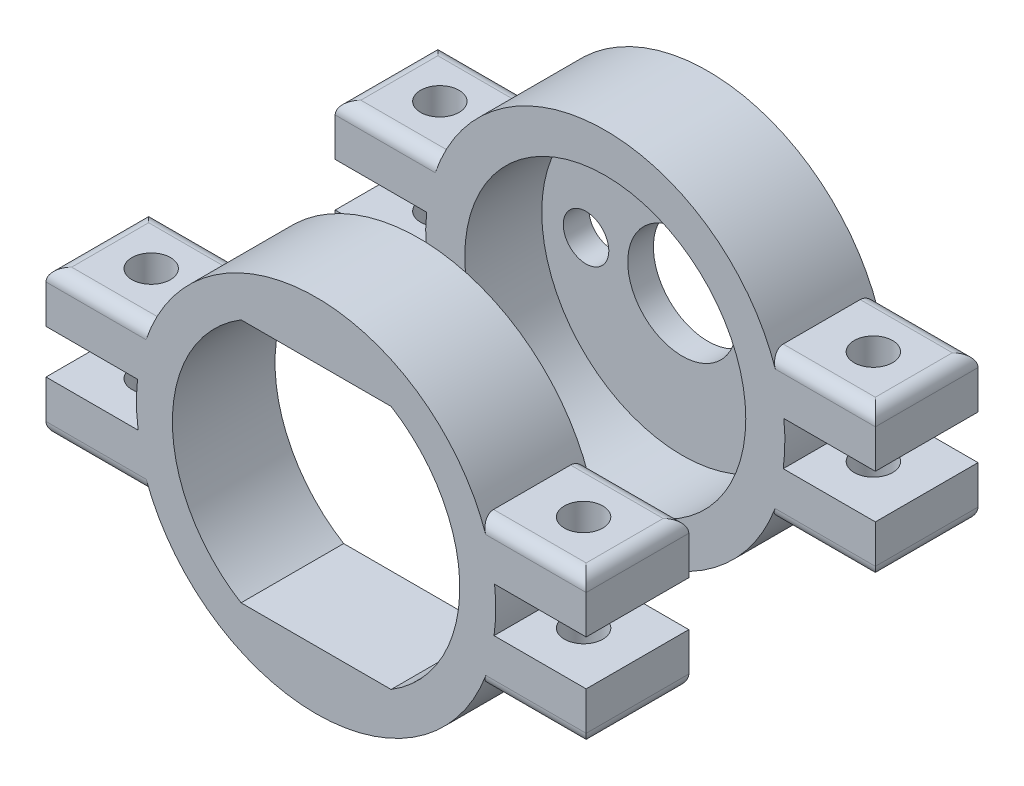
from build123d import *

# Parameters (mm, degrees)
SALIENTE_EXTRUIR1_DEPTH     = 8
CROQUIS2_R                  = 10.95
CORTAR_EXTRUIR1_DEPTH       = 6
CROQUIS3_R                  = 4.25
CROQUIS3_R_2                = 1.775
CORTAR_EXTRUIR2_DEPTH       = 3.5
SALIENTE_EXTRUIR3_DEPTH     = 8
CORTAR_EXTRUIR8_DEPTH       = 10
CORTAR_EXTRUIR9_DEPTH       = 44.54426019
CORTAR_EXTRUIR9_DEPTH_BACK  = 44.54426019
CROQUIS11_W                 = 3
CROQUIS11_H                 = 30.54
CORTAR_EXTRUIR10_DEPTH      = 42.961939121
CORTAR_EXTRUIR10_DEPTH_BACK = 42.961939121
CROQUIS8_R                  = 1.5
REDONDEO1_R                 = 1
REDONDEO2_R                 = 1


with BuildPart() as part:
    # Croquis1 → Saliente-Extruir1 (new body)
    with BuildSketch(Plane.XY):
        with BuildLine():
            Line((-13.918830485, 1.505376344), (-24.049710109, 1.505376344))
            Line((-24.049710109, 1.505376344), (-24.049710109, 5.505376344))
            Line((-24.049710109, 5.505376344), (-12.869714009, 5.505376344))
            ThreePointArc((-12.869714009, 5.505376344), (0, 13.997810806), (12.869714009, 5.505376344))
            Line((12.869714009, 5.505376344), (24.049710109, 5.505376344))
            Line((24.049710109, 5.505376344), (24.014276756, 1.505376344))
            Line((24.014276756, 1.505376344), (13.918830485, 1.505376344))
            ThreePointArc((13.918830485, 1.505376344), (13.998517204, -0.203754945), (13.869120376, -1.909842925))
            Line((13.869120376, -1.909842925), (24, -1.909842925))
            Line((24, -1.909842925), (24, -5.909842925))
            Line((24, -5.909842925), (12.8200039, -5.909842925))
            ThreePointArc((12.8200039, -5.909842925), (0, -14.11661232), (-12.8200039, -5.909842925))
            Line((-12.8200039, -5.909842925), (-24, -5.909842925))
            Line((-24, -5.909842925), (-24, -1.909842925))
            Line((-24, -1.909842925), (-13.869120376, -1.909842925))
            ThreePointArc((-13.869120376, -1.909842925), (-13.998517204, -0.203754945), (-13.918830485, 1.505376344))
        make_face()
    extrude(amount=SALIENTE_EXTRUIR1_DEPTH)

    # Croquis2 → Cortar-Extruir1 (cut)
    with BuildSketch(Plane.XY.offset(8)):
        Circle(CROQUIS2_R)
    extrude(amount=-CORTAR_EXTRUIR1_DEPTH, mode=Mode.SUBTRACT)

    # Croquis3 → Cortar-Extruir2 (cut)
    with BuildSketch(Plane.XY.offset(2)):
        Circle(CROQUIS3_R)
        with Locations((-7.5, 0)):
            Circle(CROQUIS3_R_2)
        with Locations((7.5, 0)):
            Circle(CROQUIS3_R_2)
    extrude(amount=-CORTAR_EXTRUIR2_DEPTH, mode=Mode.SUBTRACT)


with BuildPart() as body_2:
    # Croquis6 → Saliente-Extruir3 (new body)
    with BuildSketch(Plane.XY.offset(22.54)):
        with BuildLine():
            Line((-12.869714009, 5.505376344), (-24, 5.505376344))
            Line((-24, 5.505376344), (-24, 1.505376344))
            Line((-24, 1.505376344), (-13.918830485, 1.505376344))
            ThreePointArc((-13.918830485, 1.505376344), (-13.998517204, -0.203754945), (-13.869120376, -1.909842925))
            Line((-13.869120376, -1.909842925), (-24, -1.909842925))
            Line((-24, -1.909842925), (-24, -5.909842925))
            Line((-24, -5.909842925), (-12.8200039, -5.909842925))
            ThreePointArc((-12.8200039, -5.909842925), (0, -14.11661232), (12.8200039, -5.909842925))
            Line((12.8200039, -5.909842925), (24, -5.909842925))
            Line((24, -5.909842925), (24, -1.909842925))
            Line((24, -1.909842925), (13.869120376, -1.909842925))
            ThreePointArc((13.869120376, -1.909842925), (13.999072992, -0.161106695), (13.909399717, 1.590157075))
            Line((13.909399717, 1.590157075), (24, 1.590157075))
            Line((24, 1.590157075), (24, 5.590157075))
            Line((24, 5.590157075), (12.833115415, 5.590157075))
            ThreePointArc((12.833115415, 5.590157075), (-0.046171499, 13.997734658), (-12.869714009, 5.505376344))
        make_face()
    extrude(amount=SALIENTE_EXTRUIR3_DEPTH)

    # Croquis7 → Cortar-Extruir8 (cut)
    with BuildSketch(Plane.XY.offset(30.54)):
        with BuildLine():
            Line((-5.848709946, 9.551575366), (5.848709946, 9.551575366))
            ThreePointArc((5.848709946, 9.551575366), (11.2, 0), (5.848709946, -9.551575366))
            Line((5.848709946, -9.551575366), (-5.848709946, -9.551575366))
            ThreePointArc((-5.848709946, -9.551575366), (-11.2, 0), (-5.848709946, 9.551575366))
        make_face()
    extrude(amount=-CORTAR_EXTRUIR8_DEPTH, mode=Mode.SUBTRACT)


with BuildPart() as cortar_extruir9_tool:
    # Croquis11 → Cortar-Extruir9 (new, two sides: drawn at the far end of the back side and taken through both)
    with BuildSketch(Plane(origin=(0, 5.505376344, 0), x_dir=(1, 0, 0), z_dir=(0, 1, 0)).offset(-CORTAR_EXTRUIR9_DEPTH_BACK)):
        with Locations((-22.549710109, -15.27)):
            Rectangle(CROQUIS11_W, CROQUIS11_H)
        with Locations((22.549710109, -15.27)):
            Rectangle(CROQUIS11_W, CROQUIS11_H)
    extrude(amount=CORTAR_EXTRUIR9_DEPTH + CORTAR_EXTRUIR9_DEPTH_BACK)


with BuildPart() as part_1:
    add(part.part)

    # Cortar-Extruir9: cut by cortar_extruir9_tool
    add(cortar_extruir9_tool.part, mode=Mode.SUBTRACT)


with BuildPart() as body_2_1:
    add(body_2.part)

    # Cortar-Extruir9: cut by cortar_extruir9_tool
    add(cortar_extruir9_tool.part, mode=Mode.SUBTRACT)


with BuildPart() as cortar_extruir10_tool:
    # Croquis8 → Cortar-Extruir10 (new, two sides: drawn at the far end of the back side and taken through both)
    with BuildSketch(Plane(origin=(0, 5.505376344, 0), x_dir=(1, 0, 0), z_dir=(0, 1, 0)).offset(-CORTAR_EXTRUIR10_DEPTH_BACK)):
        with Locations(Location((16.85, -26.54, 0), (0, 0, 180))):
            Circle(CROQUIS8_R)
        with Locations(Location((16.894937141, -4, 0), (0, 0, 180))):
            Circle(CROQUIS8_R)
        with Locations(Location((-16.894937141, -4, 0), (0, 0, 180))):
            Circle(CROQUIS8_R)
        with Locations(Location((-16.85, -26.54, 0), (0, 0, 180))):
            Circle(CROQUIS8_R)
    extrude(amount=CORTAR_EXTRUIR10_DEPTH + CORTAR_EXTRUIR10_DEPTH_BACK)


with BuildPart() as part_2:
    add(part_1.part)

    # Cortar-Extruir10: cut by cortar_extruir10_tool
    add(cortar_extruir10_tool.part, mode=Mode.SUBTRACT)

    # Redondeo1
    redondeo1_edges = [part_2.edges().sort_by_distance(p)[0] for p in [
        (16.934857005, -5.909842925, 0),
        (-16.959712059, 5.505376344, 0),
        (16.934857005, -5.909842925, 8),
        (16.959712059, 5.505376344, 0),
        (-16.934857005, -5.909842925, 0),
        (-16.959712059, 5.505376344, 8),
        (-16.934857005, -5.909842925, 8),
        (16.959712059, 5.505376344, 8),
        (-21.049710109, -5.909842925, 4),
        (-21.049710109, 5.505376344, 4),
        (21.049710109, 5.505376344, 4),
        (21.049710109, -5.909842925, 4),
    ]]
    fillet(redondeo1_edges, radius=REDONDEO1_R)


with BuildPart() as body_2_2:
    add(body_2_1.part)

    # Cortar-Extruir10: cut by cortar_extruir10_tool
    add(cortar_extruir10_tool.part, mode=Mode.SUBTRACT)

    # Redondeo2
    redondeo2_edges = [body_2_2.edges().sort_by_distance(p)[0] for p in [
        (16.934857005, -5.909842925, 22.54),
        (-16.959712059, 5.505376344, 22.54),
        (16.934857005, -5.909842925, 30.54),
        (16.941412762, 5.590157075, 22.54),
        (-16.934857005, -5.909842925, 22.54),
        (-16.959712059, 5.505376344, 30.54),
        (-16.934857005, -5.909842925, 30.54),
        (16.941412762, 5.590157075, 30.54),
        (-21.049710109, -5.909842925, 26.54),
        (-21.049710109, 5.505376344, 26.54),
        (21.049710109, 5.590157075, 26.54),
        (21.049710109, -5.909842925, 26.54),
    ]]
    fillet(redondeo2_edges, radius=REDONDEO2_R)


solid = Compound([part_2.part, body_2_2.part])
